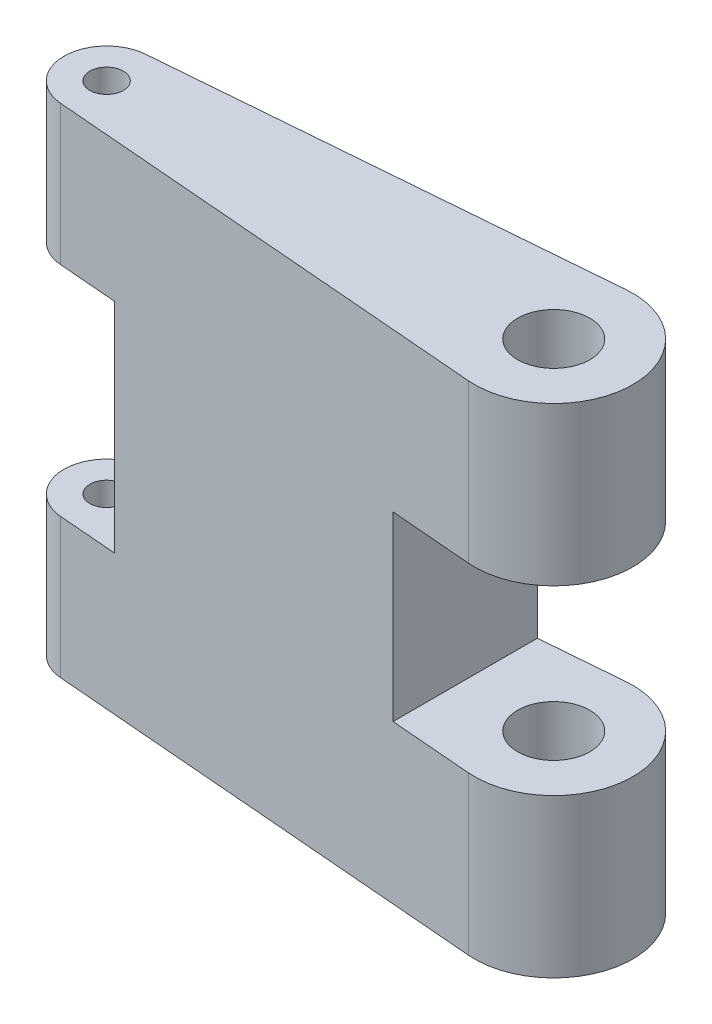
from build123d import *

# Parameters (mm, degrees)
EXTRUDE2_DEPTH          = 11.304095629
CUT_EXTRUDE5_DEPTH      = 26.221647195
CUT_EXTRUDE5_DEPTH_BACK = 26.221647195
SKETCH4_W               = 7.62
SKETCH4_H               = 8.252337146
SKETCH5_R               = 1.64
CUT_EXTRUDE6_DEPTH      = 32.929284696
EXTRUDE4_DEPTH          = 26.221647195
EXTRUDE4_DEPTH_BACK     = 26.221647195
SKETCH6_W               = 4.445
SKETCH6_H               = 9.908191258
SKETCH7_R               = 0.762
EXTRUDE5_DEPTH          = 32.929284696


with BuildPart() as part:
    # Sketch2 → Extrude2 (new, symmetric)
    with BuildSketch(Plane(origin=(0.008589011, 0, 0), x_dir=(1, 0, 0), z_dir=(0, 1, 0))):
        with BuildLine():
            Line((-0.302201676, 3.58467598), (-20.486785806, 1.931402555))
            ThreePointArc((-20.486785806, 1.931402555), (-22.266459506, 0), (-20.486785806, -1.931402555))
            Line((-20.486785806, -1.931402555), (-0.302201676, -3.58467598))
            ThreePointArc((-0.302201676, -3.58467598), (3.588091442, 0), (-0.302201676, 3.58467598))
        make_face()
    extrude(amount=EXTRUDE2_DEPTH, both=True)

    # Sketch4 → Cut-Extrude5 (cut, two sides: drawn at the far end of the back side and taken through both)
    with BuildSketch(Plane.XY.offset(-CUT_EXTRUDE5_DEPTH_BACK)):
        with Locations((-0.213319547, 0)):
            Rectangle(SKETCH4_W, SKETCH4_H)
    extrude(amount=CUT_EXTRUDE5_DEPTH + CUT_EXTRUDE5_DEPTH_BACK, mode=Mode.SUBTRACT)

    # Sketch5 → Cut-Extrude6 (cut, through all)
    with BuildSketch(Plane.XZ.offset(11.304095629)):
        with Locations(Location((0, 0, 0), (0, 0, 270))):
            Circle(SKETCH5_R)
    extrude(amount=-CUT_EXTRUDE6_DEPTH, mode=Mode.SUBTRACT)

    # Sketch6 → Extrude4 (cut, two sides: drawn at the far end of the back side and taken through both)
    with BuildSketch(Plane.XY.offset(-EXTRUDE4_DEPTH_BACK)):
        with Locations((-20.035370495, 0)):
            Rectangle(SKETCH6_W, SKETCH6_H)
    extrude(amount=EXTRUDE4_DEPTH + EXTRUDE4_DEPTH_BACK, mode=Mode.SUBTRACT)

    # Sketch7 → Extrude5 (cut, through all)
    with BuildSketch(Plane.XZ.offset(11.304095629)):
        with Locations(Location((-20.32, 0, 0), (0, 0, 270))):
            Circle(SKETCH7_R)
    extrude(amount=-EXTRUDE5_DEPTH, mode=Mode.SUBTRACT)


solid = part.part
